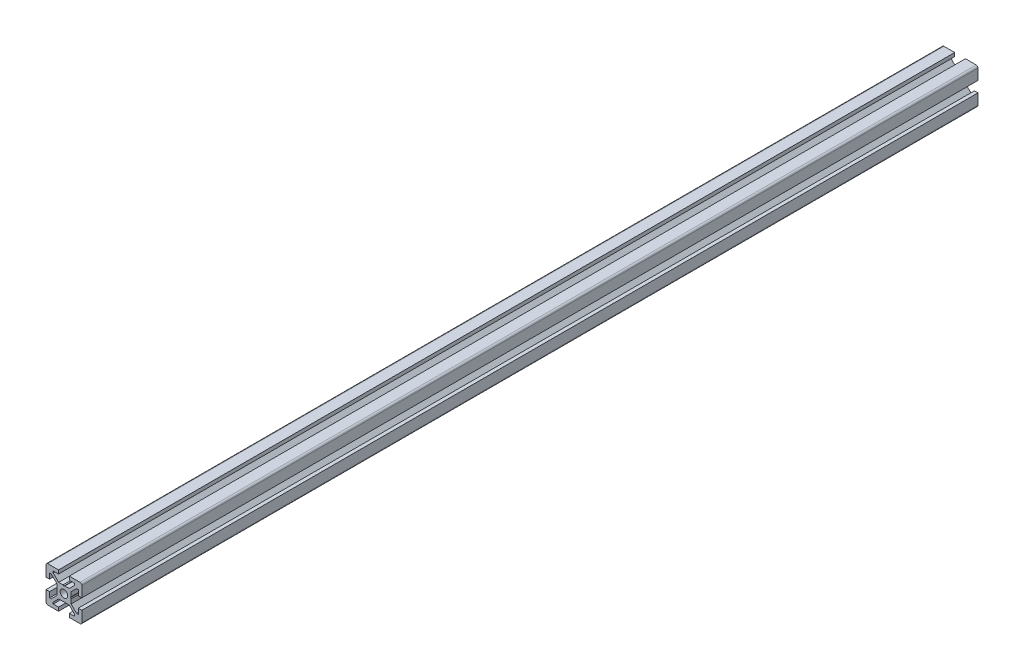
from build123d import *

# Parameters (mm, degrees)
BOSS_EXTRUDE1_DEPTH = 500
SKETCH2_W           = 500
SKETCH2_H           = 2.1


with BuildPart() as part:
    # Sketch1 → Boss-Extrude1 (new body)
    with BuildSketch(Plane.XY):
        with BuildLine():
            Line((-10, -3), (-10, -9))
            ThreePointArc((-10, -9), (-9.707106781, -9.707106781), (-9, -10))
            Line((-9, -10), (-3, -10))
            Line((-3, -10), (-3, -8))
            Line((-3, -8), (-6, -8))
            Line((-6, -8), (-6, -7.060660172))
            Line((-6, -7.060660172), (-2.939339828, -4))
            Line((-2.939339828, -4), (-0.519615242, -4))
            Line((-0.519615242, -4), (0, -3.7))
            Line((0, -3.7), (0.519615242, -4))
            Line((0.519615242, -4), (2.939339828, -4))
            Line((2.939339828, -4), (6, -7.060660172))
            Line((6, -7.060660172), (6, -8))
            Line((6, -8), (3, -8))
            Line((3, -8), (3, -10))
            Line((3, -10), (9, -10))
            ThreePointArc((9, -10), (9.707106781, -9.707106781), (10, -9))
            Line((10, -9), (10, -3))
            Line((10, -3), (8, -3))
            Line((8, -3), (8, -6))
            Line((8, -6), (7.060660172, -6))
            Line((7.060660172, -6), (4, -2.939339828))
            Line((4, -2.939339828), (4, -0.519615242))
            Line((4, -0.519615242), (3.7, 0))
            Line((3.7, 0), (4, 0.519615242))
            Line((4, 0.519615242), (4, 2.939339828))
            Line((4, 2.939339828), (7.060660172, 6))
            Line((7.060660172, 6), (8, 6))
            Line((8, 6), (8, 3))
            Line((8, 3), (10, 3))
            Line((10, 3), (10, 9))
            ThreePointArc((10, 9), (9.707106781, 9.707106781), (9, 10))
            Line((9, 10), (3, 10))
            Line((3, 10), (3, 8))
            Line((3, 8), (6, 8))
            Line((6, 8), (6, 7.060660172))
            Line((6, 7.060660172), (2.939339828, 4))
            Line((2.939339828, 4), (0.519615242, 4))
            Line((0.519615242, 4), (0, 3.7))
            Line((0, 3.7), (-0.519615242, 4))
            Line((-0.519615242, 4), (-2.939339828, 4))
            Line((-2.939339828, 4), (-6, 7.060660172))
            Line((-6, 7.060660172), (-6, 8))
            Line((-6, 8), (-3, 8))
            Line((-3, 8), (-3, 10))
            Line((-3, 10), (-9, 10))
            ThreePointArc((-9, 10), (-9.707106781, 9.707106781), (-10, 9))
            Line((-10, 9), (-10, 3))
            Line((-10, 3), (-8, 3))
            Line((-8, 3), (-8, 6))
            Line((-8, 6), (-7.060660172, 6))
            Line((-7.060660172, 6), (-4, 2.939339828))
            Line((-4, 2.939339828), (-4, 0.519615242))
            Line((-4, 0.519615242), (-3.7, 0))
            Line((-3.7, 0), (-4, -0.519615242))
            Line((-4, -0.519615242), (-4, -2.939339828))
            Line((-4, -2.939339828), (-7.060660172, -6))
            Line((-7.060660172, -6), (-8, -6))
            Line((-8, -6), (-8, -3))
            Line((-8, -3), (-10, -3))
        make_face()
    extrude(amount=-BOSS_EXTRUDE1_DEPTH)

    # Sketch2 → Cut-Revolve1 (revolve, cut)
    with BuildSketch(Plane(origin=(0, 0, 0), x_dir=(0, 0, -1), z_dir=(1, 0, 0)), mode=Mode.PRIVATE) as cut_revolve1_sk:
        with Locations((250, 1.05)):
            Rectangle(SKETCH2_W, SKETCH2_H)
    revolve(cut_revolve1_sk.sketch.rotate(Axis((0, 0, -500), (0, 0, 1)), 270), axis=Axis((0, 0, -500), (0, 0, 1)), mode=Mode.SUBTRACT)


solid = part.part
